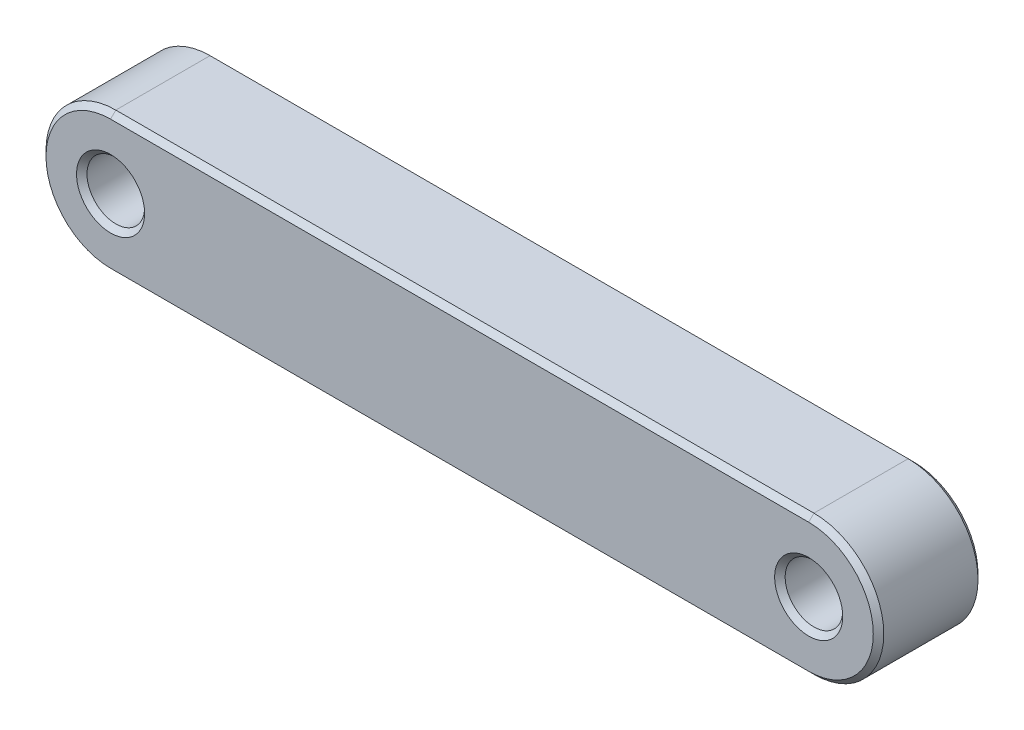
from build123d import *

# Parameters (mm, degrees)
SKETCH1_R                                    = 1.65
BOSS_EXTRUDE1_DEPTH                          = 6
CSK_FOR_M3_COUNTERSUNK_FLAT_HEAD_SCR_2_COUNT = 2
CSK_FOR_M3_COUNTERSUNK_FLAT_HEAD_SCR_2_PITCH = 40
CHAMFER1_SIZE                                = 0.3


with BuildPart() as part:
    # Sketch1 → Boss-Extrude1 (new body)
    with BuildSketch(Plane.XY):
        with BuildLine():
            Line((-20, 4), (20, 4))
            ThreePointArc((20, 4), (24, 0), (20, -4))
            Line((20, -4), (-20, -4))
            ThreePointArc((-20, -4), (-24, 0), (-20, 4))
        make_face()
        with Locations((-20, 0)):
            Circle(SKETCH1_R, mode=Mode.SUBTRACT)
        with Locations((20, 0)):
            Circle(SKETCH1_R, mode=Mode.SUBTRACT)
    extrude(amount=BOSS_EXTRUDE1_DEPTH)

    # Sketch3 → CSK for M3 Countersunk Flat Head Screw1 (revolve, cut)
    with BuildSketch(Plane.YZ.offset(-20)):
        Polygon((0, 0), (0, 6), (1.65, 6), (1.65, 2), (3.15, 0.5), (3.15, 0), align=None)
    csk_for_m3_countersunk_flat_head_screw1 = revolve(axis=Axis((-20, 0, -6.35), (0, 0, 1)), mode=Mode.SUBTRACT)

    # CSK for M3 Countersunk Flat Head Scr 2: CSK for M3 Countersunk Flat Head Screw1 ×2
    with Locations(*[(i * CSK_FOR_M3_COUNTERSUNK_FLAT_HEAD_SCR_2_PITCH, 0, 0) for i in range(1, CSK_FOR_M3_COUNTERSUNK_FLAT_HEAD_SCR_2_COUNT)]):
        add(csk_for_m3_countersunk_flat_head_screw1, mode=Mode.SUBTRACT)

    # Chamfer1
    chamfer1_edges = [part.edges().sort_by_distance(p)[0] for p in [
        (-21.65, 0, 6),
        (24, 0, 6),
        (18.35, 0, 6),
        (0, 4, 6),
        (-24, 0, 6),
        (0, 4, 0),
        (24, 0, 0),
        (0, -4, 0),
        (-24, 0, 0),
        (0, -4, 6),
    ]]
    chamfer(chamfer1_edges, length=CHAMFER1_SIZE)


solid = part.part
